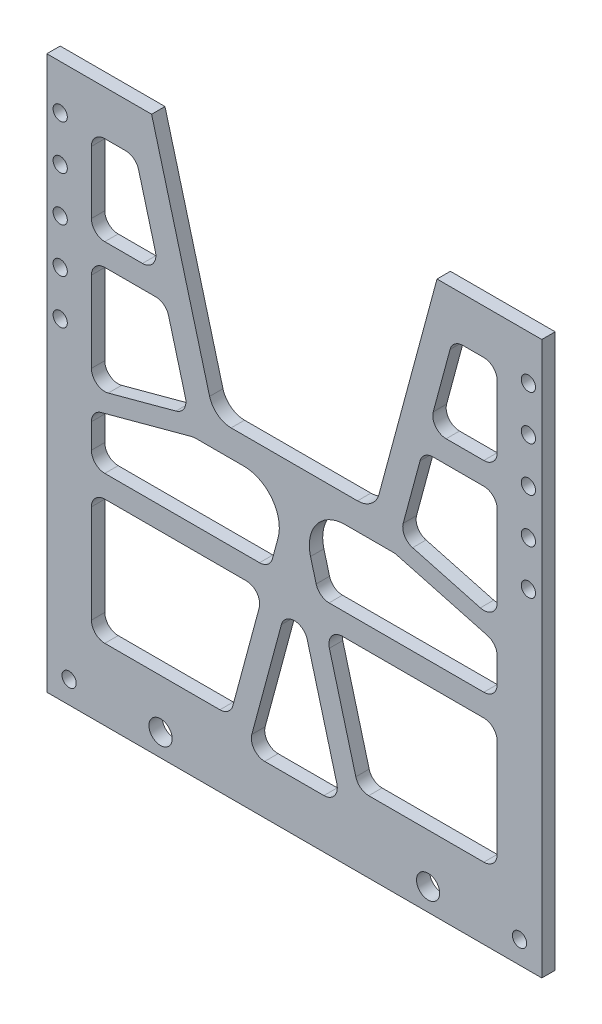
from build123d import *

# Parameters (mm, degrees)
SKETCH_1_W          = 111
SKETCH_1_H          = 124
SKETCH_1_R          = 2.6
SKETCH_1_R_2        = 1.6
EXTRUDE_1_DEPTH     = 3
SKETCH_2_R          = 1.6
CUT_EXTRUDE_1_DEPTH = 84.266139577
CUT_EXTRUDE_3_DEPTH = 84.266139577
CUT_EXTRUDE_4_DEPTH = 84.266139577
FILLET_1_R          = 8
FILLET_2_R          = 3
FILLET_3_R          = 5


with BuildPart() as part:
    # 草图1 → 凸台-拉伸1 (new body)
    with BuildSketch(Plane.XY):
        Rectangle(SKETCH_1_W, SKETCH_1_H)
        with Locations((-30, -57)):
            Circle(SKETCH_1_R, mode=Mode.SUBTRACT)
        with Locations((-50.5, -57)):
            Circle(SKETCH_1_R_2, mode=Mode.SUBTRACT)
        with Locations(Location((30, -57, 0), (0, 0, 180))):
            Circle(SKETCH_1_R, mode=Mode.SUBTRACT)
        with Locations(Location((50.5, -57, 0), (0, 0, 180))):
            Circle(SKETCH_1_R_2, mode=Mode.SUBTRACT)
    extrude(amount=EXTRUDE_1_DEPTH)

    # 草图2 → 切除-拉伸1 (cut, through all)
    with BuildSketch(Plane.XY.offset(3)):
        with Locations((-52.5, 22)):
            Circle(SKETCH_2_R)
        with Locations((-52.5, 42)):
            Circle(SKETCH_2_R)
        with Locations((-52.5, 32)):
            Circle(SKETCH_2_R)
        with Locations((-52.5, 52)):
            Circle(SKETCH_2_R)
        with Locations((-52.5, 12)):
            Circle(SKETCH_2_R)
        with Locations(Location((52.5, 12, 0), (0, 0, 180))):
            Circle(SKETCH_2_R)
        with Locations(Location((52.5, 52, 0), (0, 0, 180))):
            Circle(SKETCH_2_R)
        with Locations(Location((52.5, 32, 0), (0, 0, 180))):
            Circle(SKETCH_2_R)
        with Locations(Location((52.5, 42, 0), (0, 0, 180))):
            Circle(SKETCH_2_R)
        with Locations(Location((52.5, 22, 0), (0, 0, 180))):
            Circle(SKETCH_2_R)
    extrude(amount=-CUT_EXTRUDE_1_DEPTH, mode=Mode.SUBTRACT)

    # 草图5 → 切除-拉伸3 (cut, through all)
    with BuildSketch(Plane(origin=(0, 0, 0), x_dir=(-1, 0, 0), z_dir=(0, 0, -1))):
        Polygon((-32, 62), (-18, 10), (18, 10), (32, 62), align=None)
    extrude(amount=-CUT_EXTRUDE_3_DEPTH, mode=Mode.SUBTRACT)

    # 草图6 → 切除-拉伸4 (cut, through all)
    with BuildSketch(Plane(origin=(0, 0, 0), x_dir=(-1, 0, 0), z_dir=(0, 0, -1))):
        Polygon((-45.5, 52), (-45.5, 32), (-30.136728624, 32), (-35.521344008, 52), align=None)
        Polygon((-45.5, 1.976583298), (-23.638160979, 7.862463034), (-28.790574777, 27), (-45.5, 27), align=None)
        Polygon((-0.923076923, 4), (-22.598267085, 4), (-45.5, -2.165851169), (-45.5, -13), (-5.5, -13), align=None)
        Polygon((45.5, -2.165851169), (22.598267085, 4), (0.923076923, 4), (5.5, -13), (45.5, -13), align=None)
        Polygon((28.790574777, 27), (23.638160979, 7.862463034), (45.5, 1.976583298), (45.5, 27), align=None)
        Polygon((35.521344008, 52), (45.5, 52), (45.5, 32), (30.136728624, 32), align=None)
        Polygon((45.5, -46), (45.5, -18), (6.846153846, -18), (14.384615385, -46), align=None)
        Polygon((-45.5, -18), (-6.846153846, -18), (-14.384615385, -46), (-45.5, -46), align=None)
        Polygon((10.552726147, -51), (0, -11.804160025), (0, -51), align=None)
        Polygon((0, -51), (0, -11.804160025), (-10.552726147, -51), align=None)
    extrude(amount=-CUT_EXTRUDE_4_DEPTH, mode=Mode.SUBTRACT)

    # 圆角1
    fillet_1_edges = [part.edges().sort_by_distance(p)[0] for p in [
        (0.923076923, 4, 1.5),
        (-0.923076923, 4, 1.5),
    ]]
    fillet(fillet_1_edges, radius=FILLET_1_R)

    # 圆角2
    fillet_2_edges = [part.edges().sort_by_distance(p)[0] for p in [
        (45.5, -2.165851169, 1.5),
        (22.598267085, 4, 1.5),
        (5.5, -13, 1.5),
        (45.5, -13, 1.5),
        (45.5, 1.976583298, 1.5),
        (45.5, 27, 1.5),
        (28.790574777, 27, 1.5),
        (23.638160979, 7.862463034, 1.5),
        (-45.5, 1.976583298, 1.5),
        (-23.638160979, 7.862463034, 1.5),
        (-28.790574777, 27, 1.5),
        (-45.5, 27, 1.5),
        (-45.5, -2.165851169, 1.5),
        (-45.5, -13, 1.5),
        (-5.5, -13, 1.5),
        (-22.598267085, 4, 1.5),
        (45.5, -18, 1.5),
        (6.846153846, -18, 1.5),
        (14.384615385, -46, 1.5),
        (45.5, -46, 1.5),
        (0, -11.804160025, 1.5),
        (-10.552726147, -51, 1.5),
        (10.552726147, -51, 1.5),
        (-45.5, -18, 1.5),
        (-45.5, -46, 1.5),
        (-14.384615385, -46, 1.5),
        (-6.846153846, -18, 1.5),
        (-35.521344008, 52, 1.5),
        (-45.5, 52, 1.5),
        (-45.5, 32, 1.5),
        (-30.136728624, 32, 1.5),
        (45.5, 32, 1.5),
        (45.5, 52, 1.5),
        (35.521344008, 52, 1.5),
        (30.136728624, 32, 1.5),
    ]]
    fillet(fillet_2_edges, radius=FILLET_2_R)

    # 圆角3
    fillet_3_edges = [part.edges().sort_by_distance(p)[0] for p in [
        (-18, 10, 1.5),
        (18, 10, 1.5),
    ]]
    fillet(fillet_3_edges, radius=FILLET_3_R)


solid = part.part
